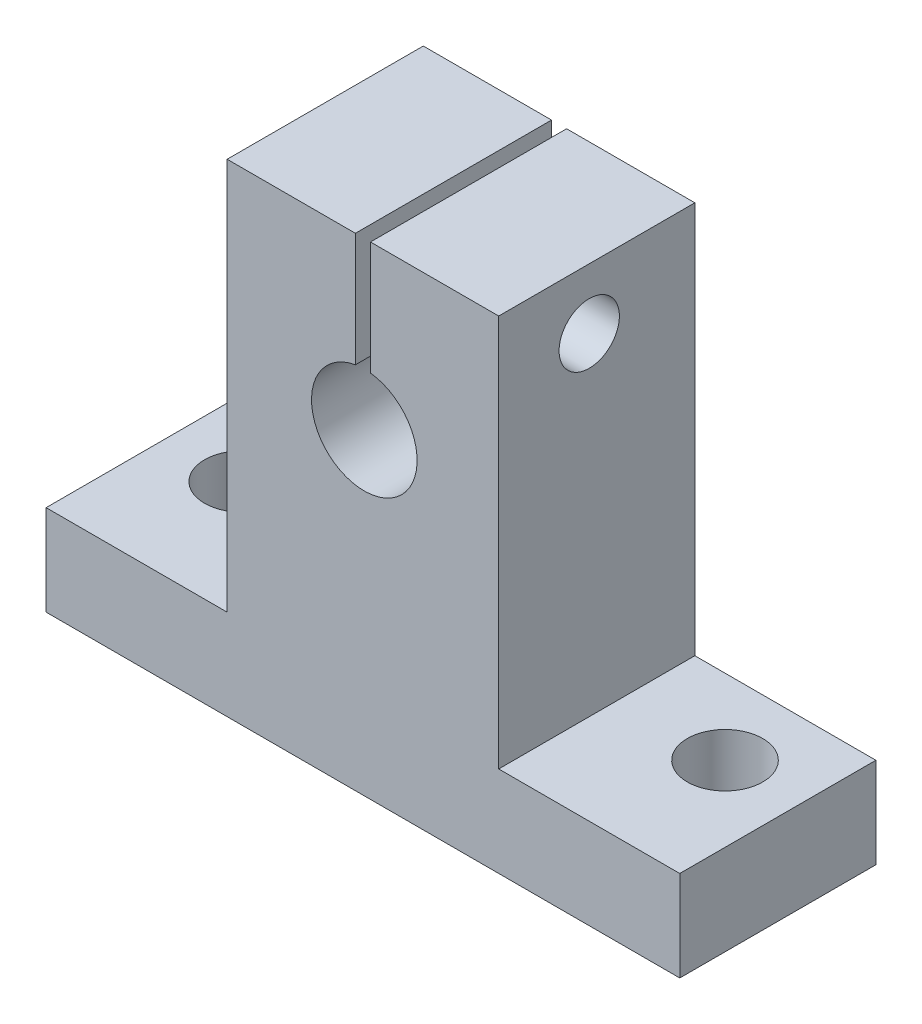
from build123d import *

# Parameters (mm, degrees)
SKETCH1_W           = 42
SKETCH1_H           = 13
SKETCH1_R           = 2.5
BOSS_EXTRUDE1_DEPTH = 6
SKETCH2_W           = 18
SKETCH2_H           = 13
BOSS_EXTRUDE2_DEPTH = 26
SKETCH3_R           = 3.5
CUT_EXTRUDE1_DEPTH  = 26
SKETCH4_R           = 2
CUT_EXTRUDE2_DEPTH  = 26


with BuildPart() as part:
    # Sketch1 → Boss-Extrude1 (new body)
    with BuildSketch(Plane(origin=(0, 0, 0), x_dir=(1, 0, 0), z_dir=(0, 1, 0))):
        Rectangle(SKETCH1_W, SKETCH1_H)
        with Locations(Location((-16, 1.5, 0), (0, 0, 270))):
            Circle(SKETCH1_R, mode=Mode.SUBTRACT)
        with Locations(Location((16, 1.5, 0), (0, 0, 270))):
            Circle(SKETCH1_R, mode=Mode.SUBTRACT)
    extrude(amount=BOSS_EXTRUDE1_DEPTH)

    # Sketch2 → Boss-Extrude2 (add)
    with BuildSketch(Plane(origin=(0, 6, 0), x_dir=(1, 0, 0), z_dir=(0, 1, 0))):
        Rectangle(SKETCH2_W, SKETCH2_H)
    extrude(amount=BOSS_EXTRUDE2_DEPTH)

    # Sketch3 → Cut-Extrude1 (cut)
    with BuildSketch(Plane.XY.offset(6.5)):
        with Locations((0.091950453, 21)):
            Circle(SKETCH3_R)
        with BuildLine():
            Line((0.5, 32), (-0.5, 32))
            Line((-0.5, 32), (-0.5, 24.449578911))
            ThreePointArc((-0.5, 24.449578911), (-0.000953562, 24.49876676), (0.5, 24.476132271))
            Line((0.5, 24.476132271), (0.5, 32))
        make_face()
    extrude(amount=-CUT_EXTRUDE1_DEPTH, mode=Mode.SUBTRACT)

    # Sketch4 → Cut-Extrude2 (cut)
    with BuildSketch(Plane(origin=(9, 0, 0), x_dir=(0, 0, -1), z_dir=(1, 0, 0))):
        with Locations((-0.5, 28)):
            Circle(SKETCH4_R)
    extrude(amount=-CUT_EXTRUDE2_DEPTH, mode=Mode.SUBTRACT)


solid = part.part
